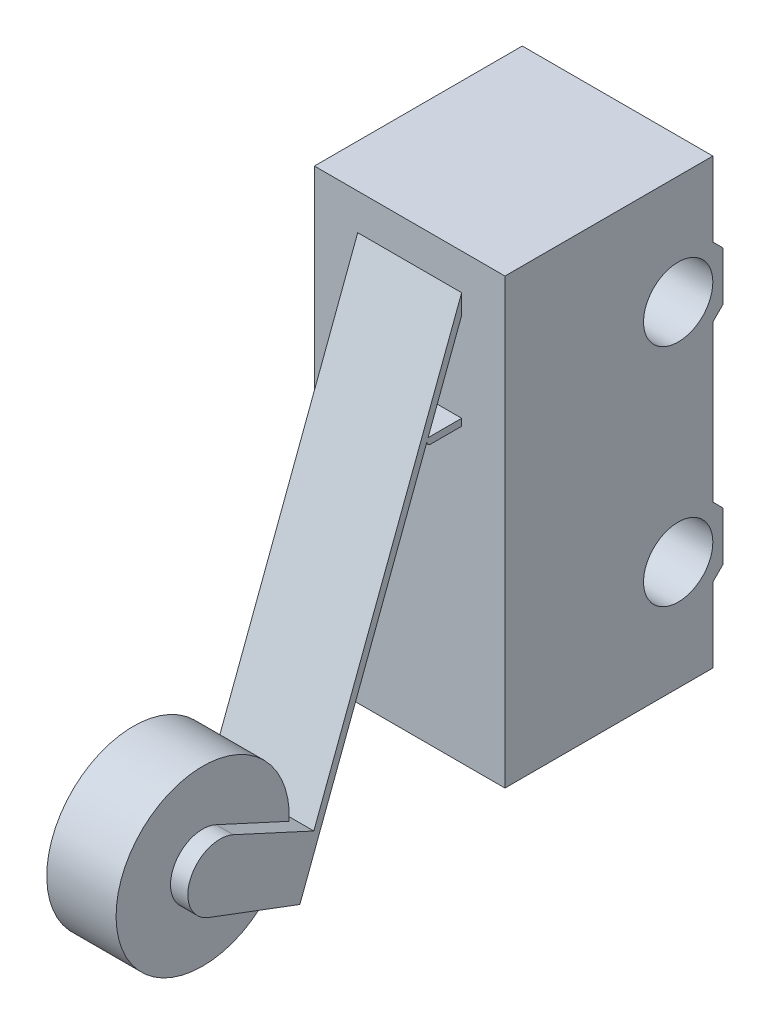
from build123d import *

# Parameters (mm, degrees)
EXTRUDE_2_DEPTH      = 2.75
EXTRUDE_2_DEPTH_BACK = 2.75
SKETCH_1_R           = 1
EXTRUDE_3_DEPTH      = 1.5
EXTRUDE_3_DEPTH_BACK = 1.5
SKETCH_3_R           = 2.5
EXTRUDE_4_DEPTH      = 1


with BuildPart() as part:
    # 草图1 → 凸台-拉伸2 (new, two sides: drawn at the far end of the back side and taken through both)
    with BuildSketch(Plane(origin=(0, 0, 0), x_dir=(0, 0, -1), z_dir=(1, 0, 0)).offset(-EXTRUDE_2_DEPTH_BACK)):
        Polygon((0, 0), (6, 0), (6, -2.15), (6.3, -2.45), (6.3, -3.85), (6, -4.15), (6, -8.65), (6.3, -8.95), (6.3, -10.35), (6, -10.65), (6, -12.8), (0, -12.8), align=None)
        with Locations((5, -3.15)):
            Circle(SKETCH_1_R, mode=Mode.SUBTRACT)
        with Locations((5, -9.65)):
            Circle(SKETCH_1_R, mode=Mode.SUBTRACT)
    extrude(amount=EXTRUDE_2_DEPTH + EXTRUDE_2_DEPTH_BACK)

    # 草图2 → 凸台-拉伸3 (add, two sides: drawn at the far end of the back side and taken through both)
    with BuildSketch(Plane(origin=(0, 0, 0), x_dir=(0, 0, -1), z_dir=(1, 0, 0)).offset(-EXTRUDE_3_DEPTH_BACK)):
        with BuildLine():
            Line((0.187151005, -1.111689384), (-0.969179354, -4.18))
            Line((-0.969179354, -4.18), (-0.9, -4.18))
            Line((-0.9, -4.18), (0, -4.18))
            Line((0, -4.18), (0, -4.38))
            Line((0, -4.38), (-0.9, -4.38))
            ThreePointArc((-0.9, -4.38), (-0.982239003, -4.336892411), (-0.993575503, -4.244734928))
            Line((-0.993575503, -4.244734928), (-1.042296193, -4.374014774))
            Line((-1.042296193, -4.374014774), (-4.669966382, -14))
            Line((-4.669966382, -14), (-4.857117387, -13.929469856))
            Line((-4.857117387, -13.929469856), (-7.302366921, -13.007947681))
            ThreePointArc((-7.302366921, -13.007947681), (-7.831389963, -11.781984382), (-6.587549984, -11.296481041))
            Line((-6.587549984, -11.296481041), (-4.266871892, -12.363259556))
            Line((-4.266871892, -12.363259556), (0, -1.04115924))
            Line((0, -1.04115924), (0.187151005, -1.111689384))
        make_face()
    extrude(amount=EXTRUDE_3_DEPTH + EXTRUDE_3_DEPTH_BACK)

    # 草图3 → 凸台-拉伸4 (add, symmetric)
    with BuildSketch(Plane(origin=(0, 0, 0), x_dir=(0, 0, -1), z_dir=(1, 0, 0))):
        with Locations((-6.975125085, -12.139614863)):
            Circle(SKETCH_3_R)
    extrude(amount=EXTRUDE_4_DEPTH, both=True)


solid = part.part
